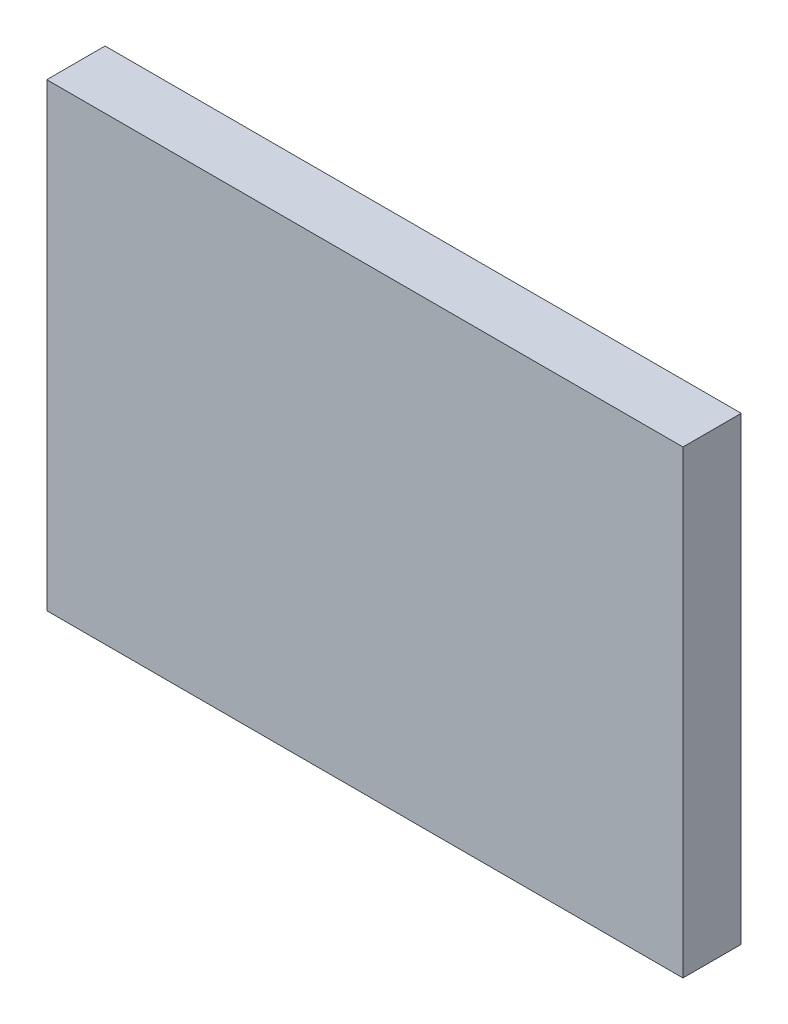
from build123d import *

# Parameters (mm, degrees)
SKIZZE1_W                       = 6.912
SKIZZE1_H                       = 3.888
AUFSATZ_LINEAR_AUSTRAGEN1_DEPTH = 1
SKIZZE2_W                       = 10.912
SKIZZE2_H                       = 7.888
AUFSATZ_LINEAR_AUSTRAGEN2_DEPTH = 1
AUFSATZ_LINEAR_AUSTRAGEN3_DEPTH = 0.48
SCHNITT_LINEAR_AUSTRAGEN1_DEPTH = 40.48


with BuildPart() as part:
    # Skizze1 → Aufsatz-Linear austragen1 (new body)
    with BuildSketch(Plane.XY):
        with Locations((3.456, 1.944)):
            Rectangle(SKIZZE1_W, SKIZZE1_H)
    extrude(amount=AUFSATZ_LINEAR_AUSTRAGEN1_DEPTH)

    # Skizze2 → Aufsatz-Linear austragen2 (add)
    with BuildSketch(Plane.XY.offset(1)):
        with Locations((3.456, 1.944)):
            Rectangle(SKIZZE2_W, SKIZZE2_H)
    extrude(amount=AUFSATZ_LINEAR_AUSTRAGEN2_DEPTH)

    # Skizze3 → Aufsatz-Linear austragen3 (add)
    with BuildSketch(Plane(origin=(0, 0, 0), x_dir=(-1, 0, 0), z_dir=(0, 0, -1))):
        Polygon((-3.956, 1.944), (-3.456, 2.444), (-2.961061255, 1.949061255), (-3.461061255, 1.449061255), align=None)
    extrude(amount=AUFSATZ_LINEAR_AUSTRAGEN3_DEPTH)

    # Skizze6 → Schnitt-Linear austragen1 (cut)
    with BuildSketch(Plane(origin=(1.006, -1.006, 0), x_dir=(0, 0, -1), z_dir=(0.7071067811865474, -0.7071067811865477, 0))):
        Polygon((0.48, 4.171930009), (0.24, 3.821955466), (0.48, 3.471980924), align=None)
    extrude(amount=-SCHNITT_LINEAR_AUSTRAGEN1_DEPTH, mode=Mode.SUBTRACT)


solid = part.part
